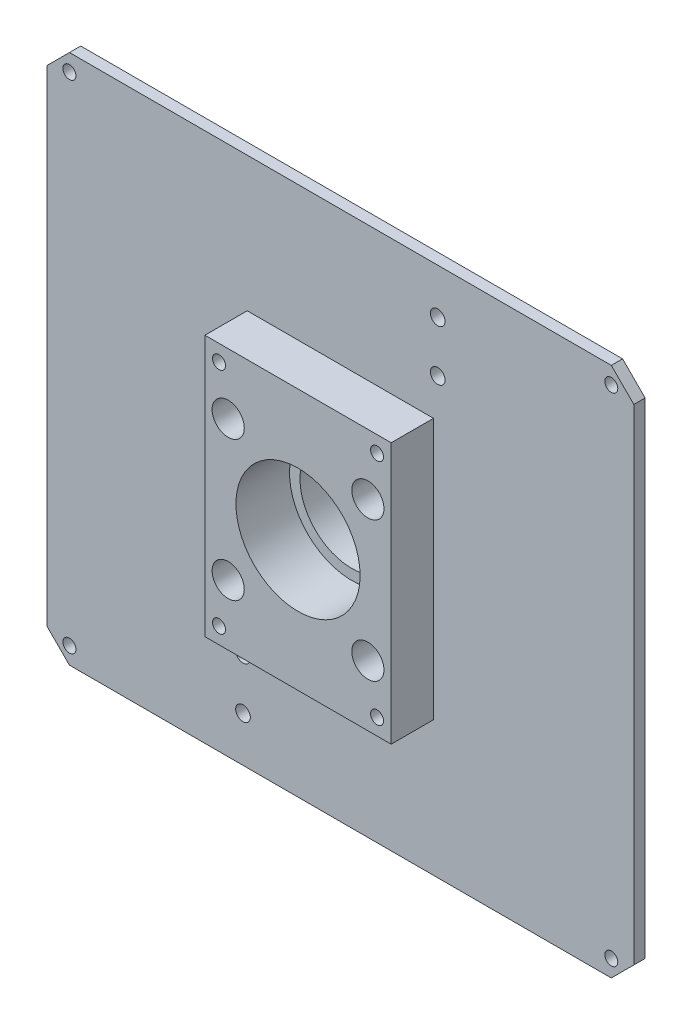
from build123d import *

# Parameters (mm, degrees)
SKETCH1_R                                      = 18.3
SKETCH1_R_2                                    = 4.65
INTEGRAL_HOLT_FLANGE_AND_STEM_CAVITY_DEPTH     = 23
SHARED_START                                   = 23
SKETCH2_R                                      = 22
SKETCH2_R_2                                    = 5.7
SKETCH2_R_3                                    = 2.3
SKETCH2_R_4                                    = 2.6
SHARED_FLAT_LOAD_PLATE_FOR_BOTH_CYLINDER_DEPTH = 4
LOWER_START                                    = 27
SKETCH3_W                                      = 66
SKETCH3_H                                      = 92.5
SKETCH3_R                                      = 22
SKETCH3_R_2                                    = 5.7
SKETCH3_R_3                                    = 2.3
LOWER_BEARING_AND_GUIDE_REGISTER_DEPTH         = 15


with BuildPart() as part:
    # Sketch1 → Integral HOLT flange and stem cavity (new body)
    with BuildSketch(Plane.XY):
        Polygon((-37, -43), (37, -43), (43, -37), (43, 37), (37, 43), (-37, 43), (-43, 37), (-43, -37), align=None)
        Circle(SKETCH1_R, mode=Mode.SUBTRACT)
        with Locations((-24.748737, -24.748737)):
            Circle(SKETCH1_R_2, mode=Mode.SUBTRACT)
        with Locations((-24.748737, 24.748737)):
            Circle(SKETCH1_R_2, mode=Mode.SUBTRACT)
        with Locations((24.748737, -24.748737)):
            Circle(SKETCH1_R_2, mode=Mode.SUBTRACT)
        with Locations((24.748737, 24.748737)):
            Circle(SKETCH1_R_2, mode=Mode.SUBTRACT)
    extrude(amount=INTEGRAL_HOLT_FLANGE_AND_STEM_CAVITY_DEPTH)

    # Sketch2 → Shared flat load plate for both cylinder mounts (add)
    with BuildSketch(Plane.XY.offset(SHARED_START)):
        Polygon((-96, -94), (96, -94), (104, -86), (104, 86), (96, 94), (-96, 94), (-104, 86), (-104, -86), align=None)
        Circle(SKETCH2_R, mode=Mode.SUBTRACT)
        with Locations((-24.748737, -24.748737)):
            Circle(SKETCH2_R_2, mode=Mode.SUBTRACT)
        with Locations((-24.748737, 24.748737)):
            Circle(SKETCH2_R_2, mode=Mode.SUBTRACT)
        with Locations((24.748737, -24.748737)):
            Circle(SKETCH2_R_2, mode=Mode.SUBTRACT)
        with Locations((24.748737, 24.748737)):
            Circle(SKETCH2_R_2, mode=Mode.SUBTRACT)
        with Locations((-96, -88)):
            Circle(SKETCH2_R_3, mode=Mode.SUBTRACT)
        with Locations((-96, 88)):
            Circle(SKETCH2_R_3, mode=Mode.SUBTRACT)
        with Locations((96, -88)):
            Circle(SKETCH2_R_3, mode=Mode.SUBTRACT)
        with Locations((96, 88)):
            Circle(SKETCH2_R_3, mode=Mode.SUBTRACT)
        with Locations((34.5, 60)):
            Circle(SKETCH2_R_4, mode=Mode.SUBTRACT)
        with Locations((34.5, 78)):
            Circle(SKETCH2_R_4, mode=Mode.SUBTRACT)
        with Locations((-34.5, -60)):
            Circle(SKETCH2_R_4, mode=Mode.SUBTRACT)
        with Locations((-34.5, -78)):
            Circle(SKETCH2_R_4, mode=Mode.SUBTRACT)
    extrude(amount=SHARED_FLAT_LOAD_PLATE_FOR_BOTH_CYLINDER_DEPTH)

    # Sketch3 → Lower bearing and guide register (add)
    with BuildSketch(Plane.XY.offset(LOWER_START)):
        Rectangle(SKETCH3_W, SKETCH3_H)
        Circle(SKETCH3_R, mode=Mode.SUBTRACT)
        with Locations((-24.748737, -24.748737)):
            Circle(SKETCH3_R_2, mode=Mode.SUBTRACT)
        with Locations((-24.748737, 24.748737)):
            Circle(SKETCH3_R_2, mode=Mode.SUBTRACT)
        with Locations((24.748737, -24.748737)):
            Circle(SKETCH3_R_2, mode=Mode.SUBTRACT)
        with Locations((24.748737, 24.748737)):
            Circle(SKETCH3_R_2, mode=Mode.SUBTRACT)
        with Locations((-28, -40.5)):
            Circle(SKETCH3_R_3, mode=Mode.SUBTRACT)
        with Locations((-28, 40.5)):
            Circle(SKETCH3_R_3, mode=Mode.SUBTRACT)
        with Locations((28, -40.5)):
            Circle(SKETCH3_R_3, mode=Mode.SUBTRACT)
        with Locations((28, 40.5)):
            Circle(SKETCH3_R_3, mode=Mode.SUBTRACT)
    extrude(amount=LOWER_BEARING_AND_GUIDE_REGISTER_DEPTH)


solid = part.part
